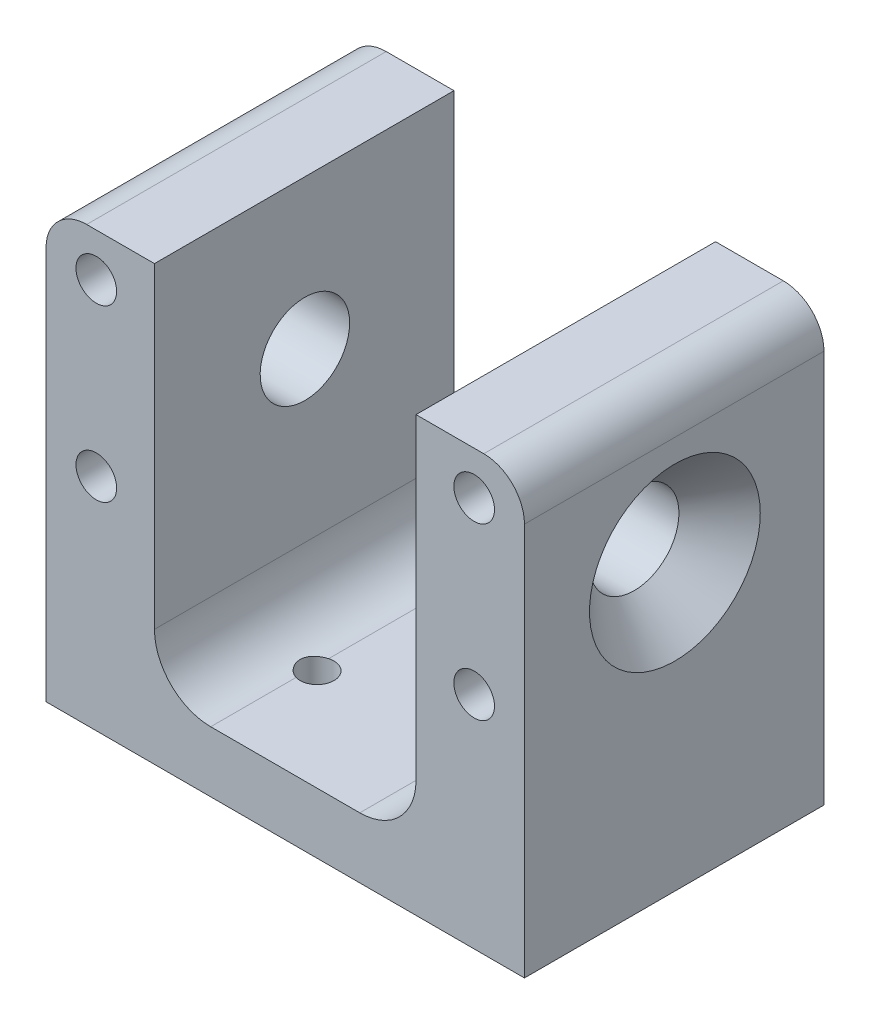
from build123d import *

# Parameters (mm, degrees)
SKETCH1_W                                           = 35.3
SKETCH1_H                                           = 22.1
BOSS_EXTRUDE1_DEPTH                                 = 32
SKETCH2_W                                           = 19.3
SKETCH2_H                                           = 27.52
CUT_EXTRUDE1_DEPTH                                  = 32
BOSS_EXTRUDE2_DEPTH                                 = 22.1
FILLET1_R                                           = 3
CSK_FOR_M6_COUNTERSUNK_FLAT_HEAD_SCREW1_D           = 6.6
CSK_FOR_M6_COUNTERSUNK_FLAT_HEAD_SCREW1_DEPTH       = 45
CSK_FOR_M6_COUNTERSUNK_FLAT_HEAD_SCREW1_CSINK_D     = 12.6
CSK_FOR_M6_COUNTERSUNK_FLAT_HEAD_SCREW1_CSINK_ANGLE = 90
CSK_FOR_M6_COUNTERSUNK_FLAT_HEAD_SCREW1_TIP         = 1.982840043
F_3_0MM_DOWEL_HOLE1_D                               = 3
F_3_0MM_DOWEL_HOLE1_DEPTH                           = 10
F_3_0MM_DOWEL_HOLE1_TIP                             = 0.901290929
F_2_5MM_DOWEL_HOLE1_D                               = 2.5
F_2_5MM_DOWEL_HOLE1_DEPTH                           = 10
F_2_5MM_DOWEL_HOLE1_TIP                             = 0.751075774


with BuildPart() as part:
    # Sketch1 → Boss-Extrude1 (new body)
    with BuildSketch(Plane(origin=(0, 0, 0), x_dir=(1, 0, 0), z_dir=(0, 1, 0))):
        with Locations((17.65, 11.05)):
            Rectangle(SKETCH1_W, SKETCH1_H)
    extrude(amount=BOSS_EXTRUDE1_DEPTH)

    # Sketch2 → Cut-Extrude1 (cut)
    with BuildSketch(Plane.XY):
        with Locations((17.65, 18.24)):
            Rectangle(SKETCH2_W, SKETCH2_H)
    extrude(amount=-CUT_EXTRUDE1_DEPTH, mode=Mode.SUBTRACT)

    # Sketch3 → Boss-Extrude2 (add)
    with BuildSketch(Plane.XY):
        with BuildLine():
            Line((8, 8.63), (8, 4.48))
            Line((8, 4.48), (12.15, 4.48))
            ThreePointArc((12.15, 4.48), (9.215506858, 5.695506858), (8, 8.63))
        make_face()
        with BuildLine():
            Line((27.3, 4.48), (27.3, 8.63))
            ThreePointArc((27.3, 8.63), (26.084493142, 5.695506858), (23.15, 4.48))
            Line((23.15, 4.48), (27.3, 4.48))
        make_face()
    extrude(amount=-BOSS_EXTRUDE2_DEPTH)

    # Fillet1
    fillet1_edges = [part.edges().sort_by_distance(p)[0] for p in [
        (35.3, 32, -11.05),
        (0, 32, -11.05),
    ]]
    fillet(fillet1_edges, radius=FILLET1_R)

    # CSK for M6 Countersunk Flat Head Screw1
    with Locations(Plane(origin=(35.3, 0, 0), x_dir=(0, 0, -1), z_dir=(1, 0, 0))):
        with Locations((11.1, 21)):
            CounterSinkHole(CSK_FOR_M6_COUNTERSUNK_FLAT_HEAD_SCREW1_D / 2, CSK_FOR_M6_COUNTERSUNK_FLAT_HEAD_SCREW1_CSINK_D / 2, depth=CSK_FOR_M6_COUNTERSUNK_FLAT_HEAD_SCREW1_DEPTH, counter_sink_angle=CSK_FOR_M6_COUNTERSUNK_FLAT_HEAD_SCREW1_CSINK_ANGLE)
            with Locations((0, 0, -(CSK_FOR_M6_COUNTERSUNK_FLAT_HEAD_SCREW1_DEPTH + CSK_FOR_M6_COUNTERSUNK_FLAT_HEAD_SCREW1_TIP / 2))):  # 118° drill point
                Cone(0, CSK_FOR_M6_COUNTERSUNK_FLAT_HEAD_SCREW1_D / 2, CSK_FOR_M6_COUNTERSUNK_FLAT_HEAD_SCREW1_TIP, mode=Mode.SUBTRACT)

    # Ø3.0mm Dowel Hole1
    with Locations(Plane.XY):
        with Locations((3.71, 28.82), (3.71, 16.26), (31.59, 28.82), (31.59, 16.26)):
            Hole(F_3_0MM_DOWEL_HOLE1_D / 2, depth=F_3_0MM_DOWEL_HOLE1_DEPTH)
            with Locations((0, 0, -(F_3_0MM_DOWEL_HOLE1_DEPTH + F_3_0MM_DOWEL_HOLE1_TIP / 2))):  # 118° drill point
                Cone(0, F_3_0MM_DOWEL_HOLE1_D / 2, F_3_0MM_DOWEL_HOLE1_TIP, mode=Mode.SUBTRACT)

    # Ø2.5mm Dowel Hole1
    with Locations(Plane(origin=(0, 0, 0), x_dir=(-1, 0, 0), z_dir=(0, -1, 0))):
        with Locations((-12.5, 7.5), (-22.8, 7.5)):
            Hole(F_2_5MM_DOWEL_HOLE1_D / 2, depth=F_2_5MM_DOWEL_HOLE1_DEPTH)
            with Locations((0, 0, -(F_2_5MM_DOWEL_HOLE1_DEPTH + F_2_5MM_DOWEL_HOLE1_TIP / 2))):  # 118° drill point
                Cone(0, F_2_5MM_DOWEL_HOLE1_D / 2, F_2_5MM_DOWEL_HOLE1_TIP, mode=Mode.SUBTRACT)


solid = part.part
